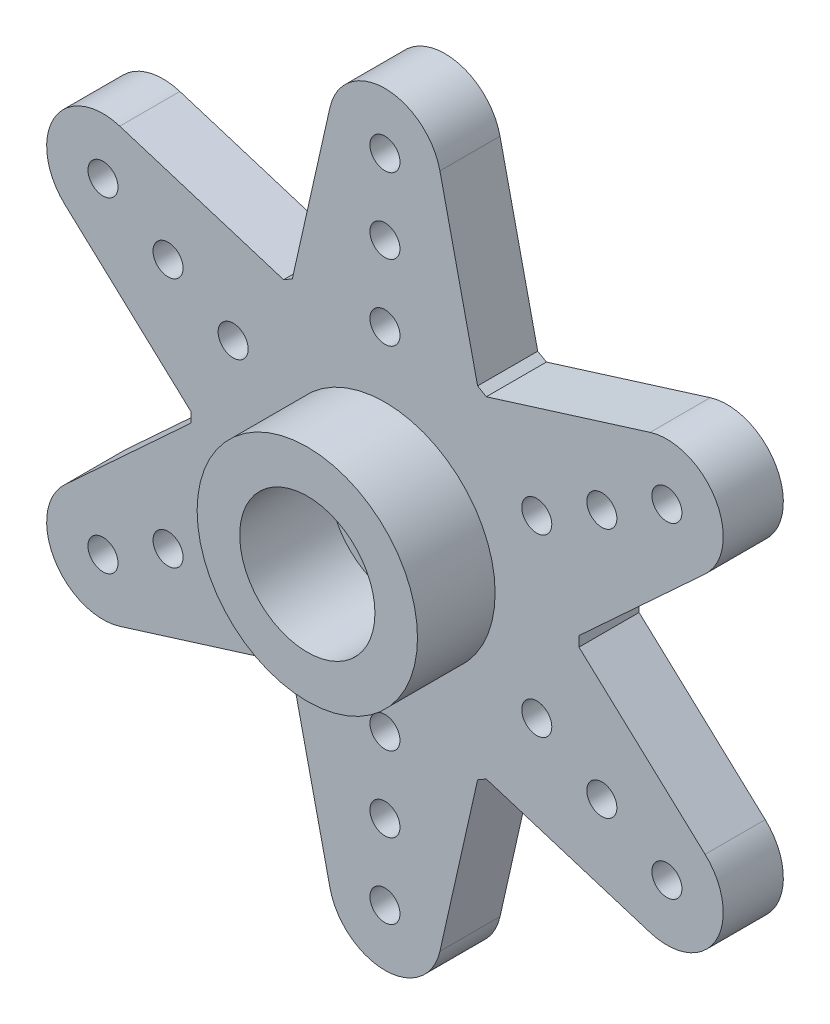
from build123d import *

# Parameters (mm, degrees)
SKIZZE1_R                       = 1.5
SKIZZE1_R_2                     = 0.6
AUFSATZ_LINEAR_AUSTRAGEN1_DEPTH = 2.4
SKIZZE2_R                       = 4.4
SKIZZE2_R_2                     = 1.5
AUFSATZ_LINEAR_AUSTRAGEN2_DEPTH = 3.1
SKIZZE4_R                       = 2.7
SCHNITT_LINEAR_AUSTRAGEN1_DEPTH = 3.6


with BuildPart() as part:
    # Skizze1 → Aufsatz-Linear austragen1 (new body)
    with BuildSketch(Plane.XY):
        with BuildLine():
            Line((-3.7, 6.809735678), (-2.195055787, 13.494196411))
            ThreePointArc((-2.195055787, 13.494196411), (0, 15.25), (2.195055787, 13.494196411))
            Line((2.195055787, 13.494196411), (3.7, 6.809735678))
            Line((3.7, 6.809735678), (4.04740409, 6.609161833))
            Line((4.04740409, 6.609161833), (10.588789002, 8.64807228))
            ThreePointArc((10.588789002, 8.64807228), (13.206887408, 7.625), (12.783844789, 4.846124131))
            Line((12.783844789, 4.846124131), (7.74740409, 0.200573845))
            Line((7.74740409, 0.200573845), (7.74740409, -0.200573845))
            Line((7.74740409, -0.200573845), (12.783844789, -4.846124131))
            ThreePointArc((12.783844789, -4.846124131), (13.206887408, -7.625), (10.588789002, -8.64807228))
            Line((10.588789002, -8.64807228), (4.04740409, -6.609161833))
            Line((4.04740409, -6.609161833), (3.7, -6.809735678))
            Line((3.7, -6.809735678), (2.195055787, -13.494196411))
            ThreePointArc((2.195055787, -13.494196411), (0, -15.25), (-2.195055787, -13.494196411))
            Line((-2.195055787, -13.494196411), (-3.7, -6.809735678))
            Line((-3.7, -6.809735678), (-4.04740409, -6.609161833))
            Line((-4.04740409, -6.609161833), (-10.588789002, -8.64807228))
            ThreePointArc((-10.588789002, -8.64807228), (-13.206887408, -7.625), (-12.783844789, -4.846124131))
            Line((-12.783844789, -4.846124131), (-7.74740409, -0.200573845))
            Line((-7.74740409, -0.200573845), (-7.74740409, 0.200573845))
            Line((-7.74740409, 0.200573845), (-12.783844789, 4.846124131))
            ThreePointArc((-12.783844789, 4.846124131), (-13.206887408, 7.625), (-10.588789002, 8.64807228))
            Line((-10.588789002, 8.64807228), (-4.04740409, 6.609161833))
            Line((-4.04740409, 6.609161833), (-3.7, 6.809735678))
        make_face()
        Circle(SKIZZE1_R, mode=Mode.SUBTRACT)
        with Locations((0, 13)):
            Circle(SKIZZE1_R_2, mode=Mode.SUBTRACT)
        with Locations((0, 10)):
            Circle(SKIZZE1_R_2, mode=Mode.SUBTRACT)
        with Locations((0, 7)):
            Circle(SKIZZE1_R_2, mode=Mode.SUBTRACT)
        with Locations((6.062177826, 3.5)):
            Circle(SKIZZE1_R_2, mode=Mode.SUBTRACT)
        with Locations((8.660254038, 5)):
            Circle(SKIZZE1_R_2, mode=Mode.SUBTRACT)
        with Locations((11.258330249, 6.5)):
            Circle(SKIZZE1_R_2, mode=Mode.SUBTRACT)
        with Locations((6.062177826, -3.5)):
            Circle(SKIZZE1_R_2, mode=Mode.SUBTRACT)
        with Locations((8.660254038, -5)):
            Circle(SKIZZE1_R_2, mode=Mode.SUBTRACT)
        with Locations((11.258330249, -6.5)):
            Circle(SKIZZE1_R_2, mode=Mode.SUBTRACT)
        with Locations((0, -7)):
            Circle(SKIZZE1_R_2, mode=Mode.SUBTRACT)
        with Locations((0, -10)):
            Circle(SKIZZE1_R_2, mode=Mode.SUBTRACT)
        with Locations((0, -13)):
            Circle(SKIZZE1_R_2, mode=Mode.SUBTRACT)
        with Locations((-6.062177826, -3.5)):
            Circle(SKIZZE1_R_2, mode=Mode.SUBTRACT)
        with Locations((-8.660254038, -5)):
            Circle(SKIZZE1_R_2, mode=Mode.SUBTRACT)
        with Locations((-11.258330249, -6.5)):
            Circle(SKIZZE1_R_2, mode=Mode.SUBTRACT)
        with Locations((-6.062177826, 3.5)):
            Circle(SKIZZE1_R_2, mode=Mode.SUBTRACT)
        with Locations((-8.660254038, 5)):
            Circle(SKIZZE1_R_2, mode=Mode.SUBTRACT)
        with Locations((-11.258330249, 6.5)):
            Circle(SKIZZE1_R_2, mode=Mode.SUBTRACT)
    extrude(amount=AUFSATZ_LINEAR_AUSTRAGEN1_DEPTH)

    # Skizze2 → Aufsatz-Linear austragen2 (add)
    with BuildSketch(Plane.XY.offset(2.4)):
        with Locations(Location((0, 0, 0), (0, 0, 180))):
            Circle(SKIZZE2_R)
        Circle(SKIZZE2_R_2, mode=Mode.SUBTRACT)
    extrude(amount=AUFSATZ_LINEAR_AUSTRAGEN2_DEPTH)

    # Skizze4 → Schnitt-Linear austragen1 (cut)
    with BuildSketch(Plane.XY.offset(5.5)):
        Circle(SKIZZE4_R)
    extrude(amount=-SCHNITT_LINEAR_AUSTRAGEN1_DEPTH, mode=Mode.SUBTRACT)


solid = part.part
